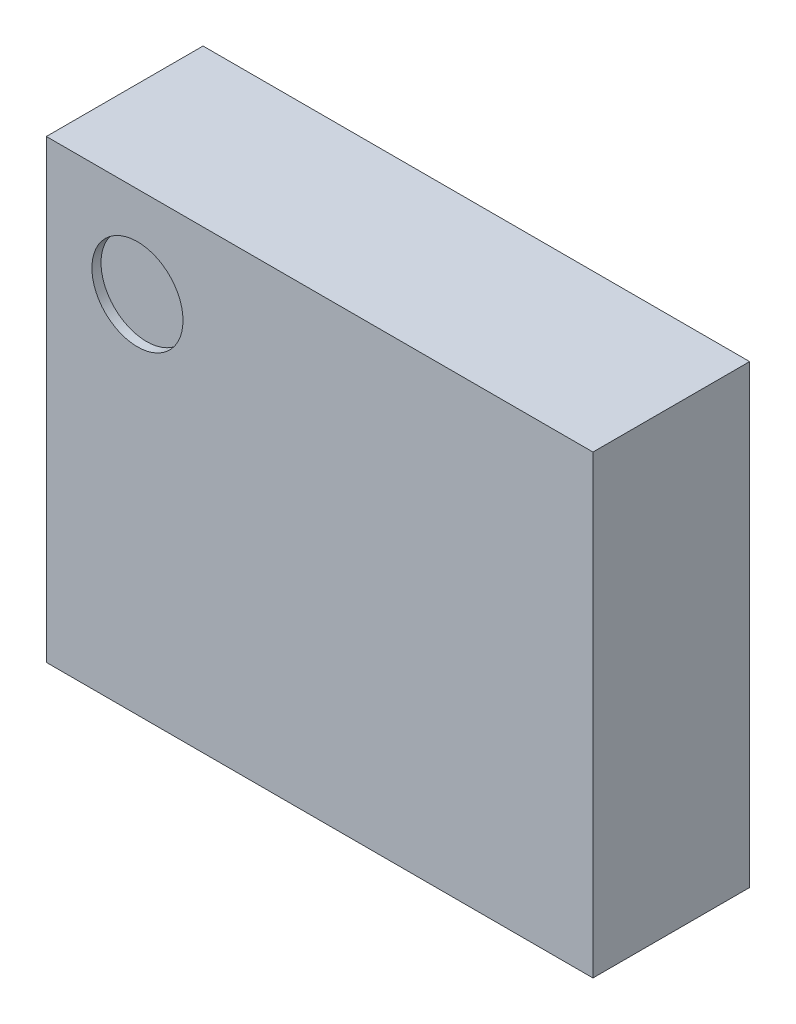
from build123d import *

# Parameters (mm, degrees)
SKETCH1_W           = 3
SKETCH1_H           = 2.5
BOSS_EXTRUDE1_DEPTH = 0.86
SKETCH2_R           = 0.25
CUT_EXTRUDE1_DEPTH  = 0.05


with BuildPart() as part:
    # Sketch1 → Boss-Extrude1 (new body)
    with BuildSketch(Plane.XY):
        Rectangle(SKETCH1_W, SKETCH1_H)
    extrude(amount=BOSS_EXTRUDE1_DEPTH)

    # Sketch2 → Cut-Extrude1 (cut)
    with BuildSketch(Plane.XY.offset(0.86)):
        with Locations((-1, 0.75)):
            Circle(SKETCH2_R)
    extrude(amount=-CUT_EXTRUDE1_DEPTH, mode=Mode.SUBTRACT)


solid = part.part
